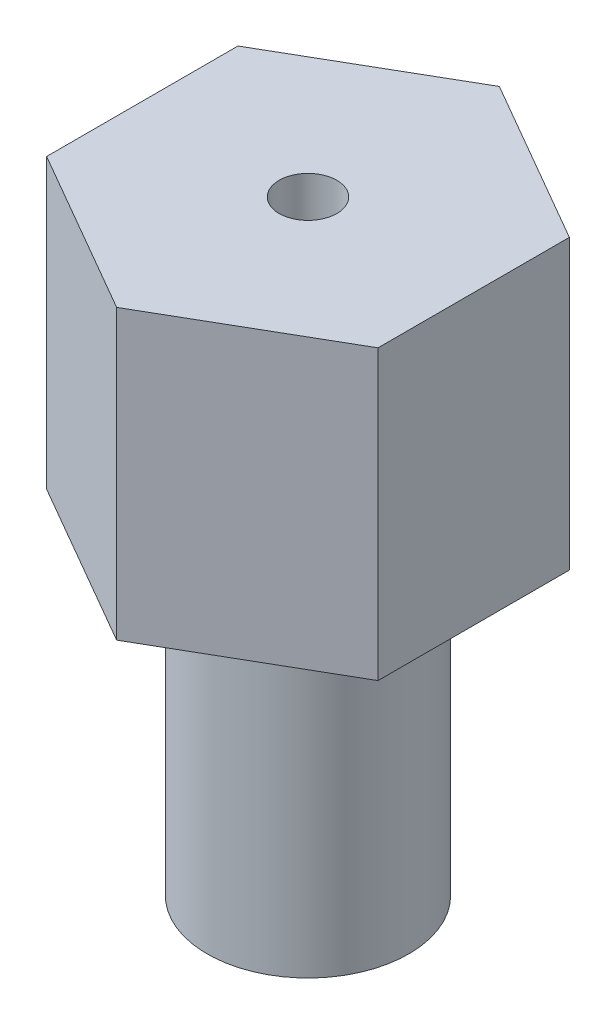
from build123d import *

# Parameters (mm, degrees)
SALIENTE_EXTRUIR1_DEPTH = 10
CROQUIS2_R              = 3.5
SALIENTE_EXTRUIR2_DEPTH = 11
CROQUIS3_R              = 1
CORTAR_EXTRUIR1_DEPTH   = 40


with BuildPart() as part:
    # Croquis1 → Saliente-Extruir1 (new body)
    with BuildSketch(Plane(origin=(0, 0, 0), x_dir=(1, 0, 0), z_dir=(0, 1, 0))):
        Polygon((0, 6.639528096), (-5.75, 3.319764048), (-5.75, -3.319764048), (0, -6.639528096), (5.75, -3.319764048), (5.75, 3.319764048), align=None)
    extrude(amount=SALIENTE_EXTRUIR1_DEPTH)

    # Croquis2 → Saliente-Extruir2 (add)
    with BuildSketch(Plane.XZ):
        with Locations(Location((0, 0, 0), (0, 0, 270))):
            Circle(CROQUIS2_R)
    extrude(amount=SALIENTE_EXTRUIR2_DEPTH)

    # Croquis3 → Cortar-Extruir1 (cut)
    with BuildSketch(Plane.XZ.offset(11)):
        with Locations(Location((0, 0, 0), (0, 0, 270))):
            Circle(CROQUIS3_R)
    extrude(amount=-CORTAR_EXTRUIR1_DEPTH, mode=Mode.SUBTRACT)


solid = part.part
